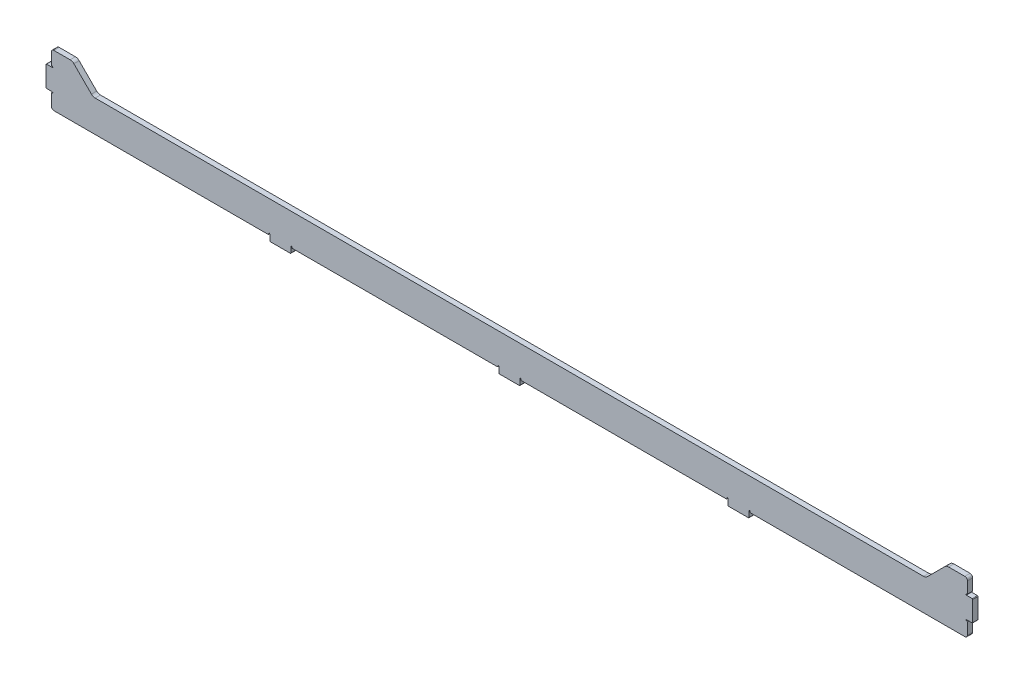
from build123d import *

# Parameters (mm, degrees)
BOSS_EXTRUDE1_DEPTH = 3.175
FILLET1_R           = 3.175
FILLET2_R           = 1.5875
SKETCH3_W           = 3.175
SKETCH3_H           = 12.7
SKETCH3_W_2         = 12.7
SKETCH3_H_2         = 3.175
SKETCH3_W_3         = 6.35
BOSS_EXTRUDE2_DEPTH = 3.175
CUT_EXTRUDE1_DEPTH  = 282.187550651
FILLET3_R           = 0.3175


with BuildPart() as part:
    # Sketch1 → Boss-Extrude1 (new body)
    with BuildSketch(Plane.XY):
        Polygon((-276.225, 0), (276.225, 0), (276.225, 31.496), (263.525, 31.496), (251.079, 19.05), (-251.079, 19.05), (-263.525, 31.496), (-276.225, 31.496), align=None)
    extrude(amount=BOSS_EXTRUDE1_DEPTH)

    # Fillet1
    fillet1_edges = [part.edges().sort_by_distance(p)[0] for p in [
        (-263.525, 31.496, 1.5875),
        (-251.079, 19.05, 1.5875),
        (251.079, 19.05, 1.5875),
        (263.525, 31.496, 1.5875),
    ]]
    fillet(fillet1_edges, radius=FILLET1_R)

    # Fillet2
    fillet2_edges = [part.edges().sort_by_distance(p)[0] for p in [
        (-276.225, 31.496, 1.5875),
        (276.225, 31.496, 1.5875),
        (276.225, 0, 1.5875),
        (-276.225, 0, 1.5875),
    ]]
    fillet(fillet2_edges, radius=FILLET2_R)

    # Sketch3 → Boss-Extrude2 (add)
    with BuildSketch(Plane.XY.offset(3.175)):
        with Locations((277.8125, 15.748)):
            Rectangle(SKETCH3_W, SKETCH3_H)
        with Locations((138.1125, -1.5875)):
            Rectangle(SKETCH3_W_2, SKETCH3_H_2)
        with Locations((3.175, -1.5875)):
            Rectangle(SKETCH3_W_3, SKETCH3_H_2)
    boss_extrude2 = extrude(amount=-BOSS_EXTRUDE2_DEPTH)

    # Mirror1: Boss-Extrude2 across plane
    add(boss_extrude2.mirror(Plane(origin=(0, 0, 0), x_dir=(0, 0, 1), z_dir=(1, 0, 0))))

    # Sketch4 → Cut-Extrude1 (cut, through all)
    with BuildSketch(Plane.XY.offset(3.175)):
        with BuildLine():
            Line((-276.225, 22.733), (-275.59, 22.733))
            ThreePointArc((-275.59, 22.733), (-275.2725, 22.4155), (-275.59, 22.098))
            Line((-275.59, 22.098), (-276.225, 22.098))
            ThreePointArc((-276.225, 22.098), (-276.5425, 22.4155), (-276.225, 22.733))
        make_face()
        with BuildLine():
            Line((-276.225, 9.398), (-275.59, 9.398))
            ThreePointArc((-275.59, 9.398), (-275.2725, 9.0805), (-275.59, 8.763))
            Line((-275.59, 8.763), (-276.225, 8.763))
            ThreePointArc((-276.225, 8.763), (-276.5425, 9.0805), (-276.225, 9.398))
        make_face()
        with BuildLine():
            Line((-145.0975, 0), (-145.0975, 0.635))
            ThreePointArc((-145.0975, 0.635), (-144.78, 0.9525), (-144.4625, 0.635))
            Line((-144.4625, 0.635), (-144.4625, 0))
            ThreePointArc((-144.4625, 0), (-144.78, -0.3175), (-145.0975, 0))
        make_face()
        with BuildLine():
            Line((-131.1275, 0.635), (-131.1275, 0))
            ThreePointArc((-131.1275, 0), (-131.445, -0.3175), (-131.7625, 0))
            Line((-131.7625, 0), (-131.7625, 0.635))
            ThreePointArc((-131.7625, 0.635), (-131.445, 0.9525), (-131.1275, 0.635))
        make_face()
        with BuildLine():
            Line((-6.985, 0), (-6.985, 0.635))
            ThreePointArc((-6.985, 0.635), (-6.6675, 0.9525), (-6.35, 0.635))
            Line((-6.35, 0.635), (-6.35, 0))
            ThreePointArc((-6.35, 0), (-6.6675, -0.3175), (-6.985, 0))
        make_face()
    cut_extrude1 = extrude(amount=-CUT_EXTRUDE1_DEPTH, mode=Mode.SUBTRACT)

    # Mirror2: Cut-Extrude1 across plane
    add(cut_extrude1.mirror(Plane(origin=(0, 0, 0), x_dir=(0, 0, 1), z_dir=(1, 0, 0))), mode=Mode.SUBTRACT)

    # Fillet3
    fillet3_edges = [part.edges().sort_by_distance(p)[0] for p in [
        (-279.4, 22.098, 1.5875),
        (-279.4, 9.398, 1.5875),
        (-144.4625, -3.175, 1.5875),
        (-131.7625, -3.175, 1.5875),
        (-6.35, -3.175, 1.5875),
        (-276.225, 22.733, 1.5875),
        (-276.225, 8.763, 1.5875),
        (-145.0975, 0, 1.5875),
        (-131.1275, 0, 1.5875),
        (-6.985, 0, 1.5875),
        (276.225, 22.733, 1.5875),
        (276.225, 8.763, 1.5875),
        (145.0975, 0, 1.5875),
        (131.1275, 0, 1.5875),
        (6.985, 0, 1.5875),
        (279.4, 22.098, 1.5875),
        (279.4, 9.398, 1.5875),
        (131.7625, -3.175, 1.5875),
        (144.4625, -3.175, 1.5875),
        (6.35, -3.175, 1.5875),
    ]]
    fillet(fillet3_edges, radius=FILLET3_R)


solid = part.part
